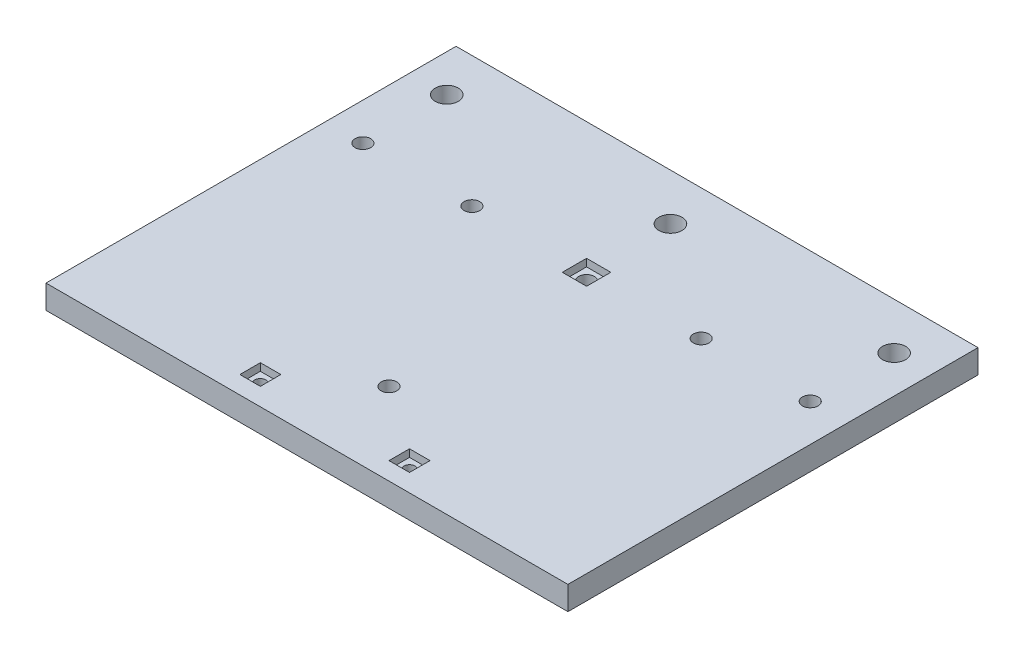
from build123d import *

# Parameters (mm, degrees)
SKETCH2_W           = 140
SKETCH2_H           = 110
SKETCH2_R           = 2.1
SKETCH2_R_2         = 3.1
SKETCH2_R_3         = 1.5
BOSS_EXTRUDE2_DEPTH = 6.35
SKETCH3_W           = 6.5
SKETCH3_H           = 6.5
SKETCH3_W_2         = 5.5
SKETCH3_H_2         = 5.5
CUT_EXTRUDE1_DEPTH  = 2


with BuildPart() as part:
    # Sketch2 → Boss-Extrude2 (new body)
    with BuildSketch(Plane(origin=(0, 0, 0), x_dir=(1, 0, 0), z_dir=(0, 1, 0))):
        with Locations((70, 55)):
            Rectangle(SKETCH2_W, SKETCH2_H)
        with Locations(Location((39.25, 75, 0), (0, 0, 270))):
            Circle(SKETCH2_R, mode=Mode.SUBTRACT)
        with Locations(Location((100.75, 75, 0), (0, 0, 270))):
            Circle(SKETCH2_R, mode=Mode.SUBTRACT)
        with Locations(Location((70, 22, 0), (0, 0, 270))):
            Circle(SKETCH2_R, mode=Mode.SUBTRACT)
        with Locations(Location((10, 97.5, 0), (0, 0, 270))):
            Circle(SKETCH2_R_2, mode=Mode.SUBTRACT)
        with Locations(Location((70, 97.5, 0), (0, 0, 270))):
            Circle(SKETCH2_R_2, mode=Mode.SUBTRACT)
        with Locations(Location((130, 97.5, 0), (0, 0, 270))):
            Circle(SKETCH2_R_2, mode=Mode.SUBTRACT)
        with Locations(Location((10, 75, 0), (0, 0, 270))):
            Circle(SKETCH2_R, mode=Mode.SUBTRACT)
        with Locations(Location((70, 75, 0), (0, 0, 270))):
            Circle(SKETCH2_R, mode=Mode.SUBTRACT)
        with Locations(Location((130, 75, 0), (0, 0, 270))):
            Circle(SKETCH2_R, mode=Mode.SUBTRACT)
        with Locations(Location((50, 7.5, 0), (0, 0, 270))):
            Circle(SKETCH2_R_3, mode=Mode.SUBTRACT)
        with Locations(Location((90, 7.5, 0), (0, 0, 270))):
            Circle(SKETCH2_R_3, mode=Mode.SUBTRACT)
    extrude(amount=BOSS_EXTRUDE2_DEPTH)

    # Sketch3 → Cut-Extrude1 (cut)
    with BuildSketch(Plane(origin=(0, 6.35, 0), x_dir=(1, 0, 0), z_dir=(0, 1, 0))):
        with Locations((70, 75)):
            Rectangle(SKETCH3_W, SKETCH3_H)
        with Locations((50, 7.5)):
            Rectangle(SKETCH3_W_2, SKETCH3_H_2)
        with Locations((90, 7.5)):
            Rectangle(SKETCH3_W_2, SKETCH3_H_2)
    extrude(amount=-CUT_EXTRUDE1_DEPTH, mode=Mode.SUBTRACT)


solid = part.part
